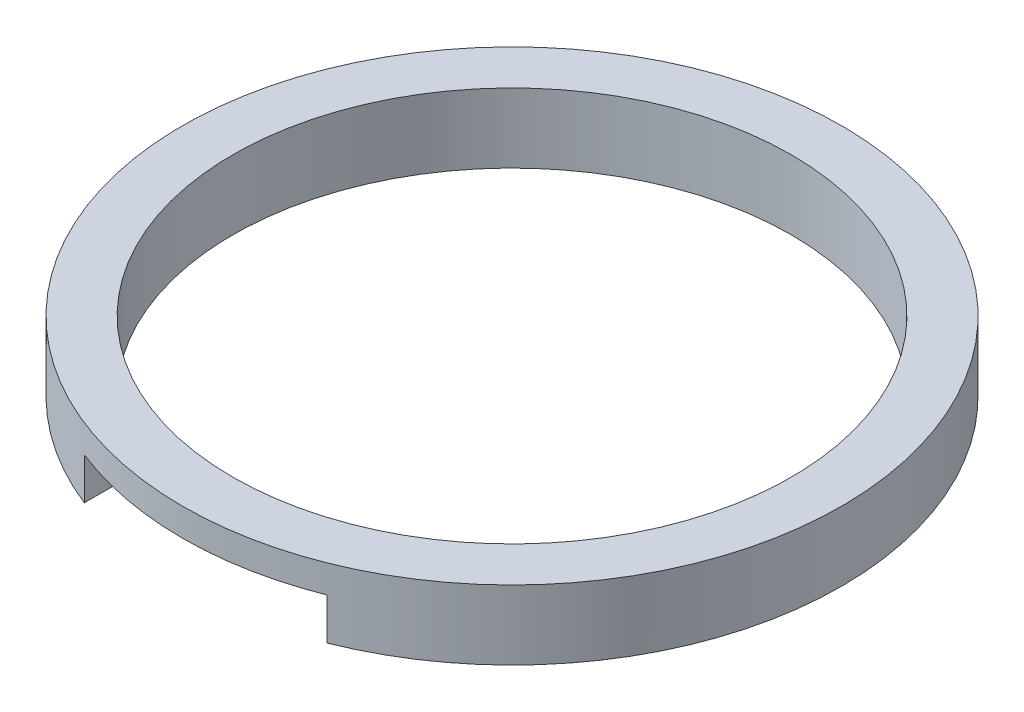
from build123d import *

# Parameters (mm, degrees)
SKETCH1_R           = 9.5
BOSS_EXTRUDE1_DEPTH = 2
SKETCH2_R           = 8.05
CUT_EXTRUDE1_DEPTH  = 14.583077707
CUT_EXTRUDE2_DEPTH  = 1.2


with BuildPart() as part:
    # Sketch1 → Boss-Extrude1 (new body)
    with BuildSketch(Plane(origin=(0, 0, 0), x_dir=(1, 0, 0), z_dir=(0, 1, 0))):
        with Locations(Location((0, 0, 0), (0, 0, 270))):
            Circle(SKETCH1_R)
    extrude(amount=BOSS_EXTRUDE1_DEPTH)

    # Sketch2 → Cut-Extrude1 (cut, through all)
    with BuildSketch(Plane(origin=(0, 2, 0), x_dir=(1, 0, 0), z_dir=(0, 1, 0))):
        with Locations(Location((0, 0, 0), (0, 0, 270))):
            Circle(SKETCH2_R)
    extrude(amount=-CUT_EXTRUDE1_DEPTH, mode=Mode.SUBTRACT)

    # Sketch3 → Cut-Extrude2 (cut)
    with BuildSketch(Plane.XZ):
        with BuildLine():
            Line((-3.5, 7.249310312), (-3.5, 8.831760866))
            ThreePointArc((-3.5, 8.831760866), (0, 9.5), (3.5, 8.831760866))
            Line((3.5, 8.831760866), (3.5, 7.249310312))
            ThreePointArc((3.5, 7.249310312), (0, 8.05), (-3.5, 7.249310312))
        make_face()
    extrude(amount=-CUT_EXTRUDE2_DEPTH, mode=Mode.SUBTRACT)


solid = part.part
